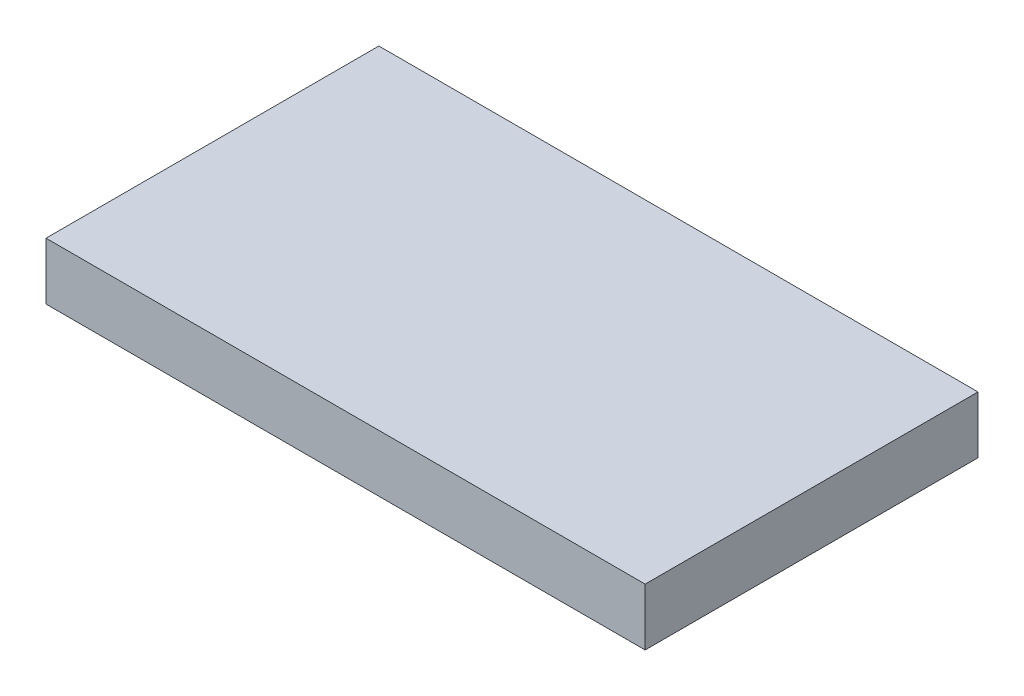
from build123d import *

# Parameters (mm, degrees)
SKETCH_1_W      = 63
SKETCH_1_H      = 35
EXTRUDE_1_DEPTH = 6


with BuildPart() as part:
    # Эскиз1 → Бобышка-Вытянуть1 (new body)
    with BuildSketch(Plane(origin=(0, 0, 0), x_dir=(1, 0, 0), z_dir=(0, 1, 0))):
        with Locations((31.5, 17.5)):
            Rectangle(SKETCH_1_W, SKETCH_1_H)
    extrude(amount=EXTRUDE_1_DEPTH)


solid = part.part
